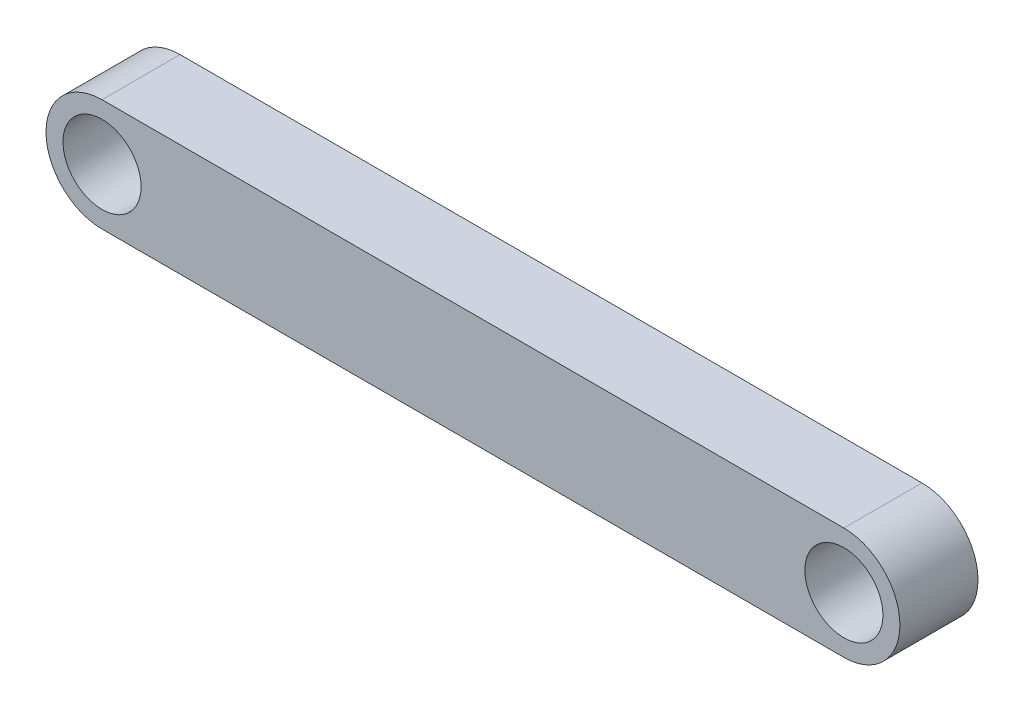
from build123d import *

# Parameters (mm, degrees)
SKETCH1_R           = 1
BOSS_EXTRUDE1_DEPTH = 2


with BuildPart() as part:
    # Sketch1 → Boss-Extrude1 (new body)
    with BuildSketch(Plane.XY):
        with BuildLine():
            Line((-9.073469388, 1.434693878), (9.926530612, 1.434693878))
            ThreePointArc((9.926530612, 1.434693878), (11.36122449, 0), (9.926530612, -1.434693878))
            Line((9.926530612, -1.434693878), (-9.073469388, -1.434693878))
            ThreePointArc((-9.073469388, -1.434693878), (-10.508163265, 0), (-9.073469388, 1.434693878))
        make_face()
        with Locations((9.926530612, 0)):
            Circle(SKETCH1_R, mode=Mode.SUBTRACT)
        with Locations((-9.073469388, 0)):
            Circle(SKETCH1_R, mode=Mode.SUBTRACT)
    extrude(amount=BOSS_EXTRUDE1_DEPTH)


solid = part.part
